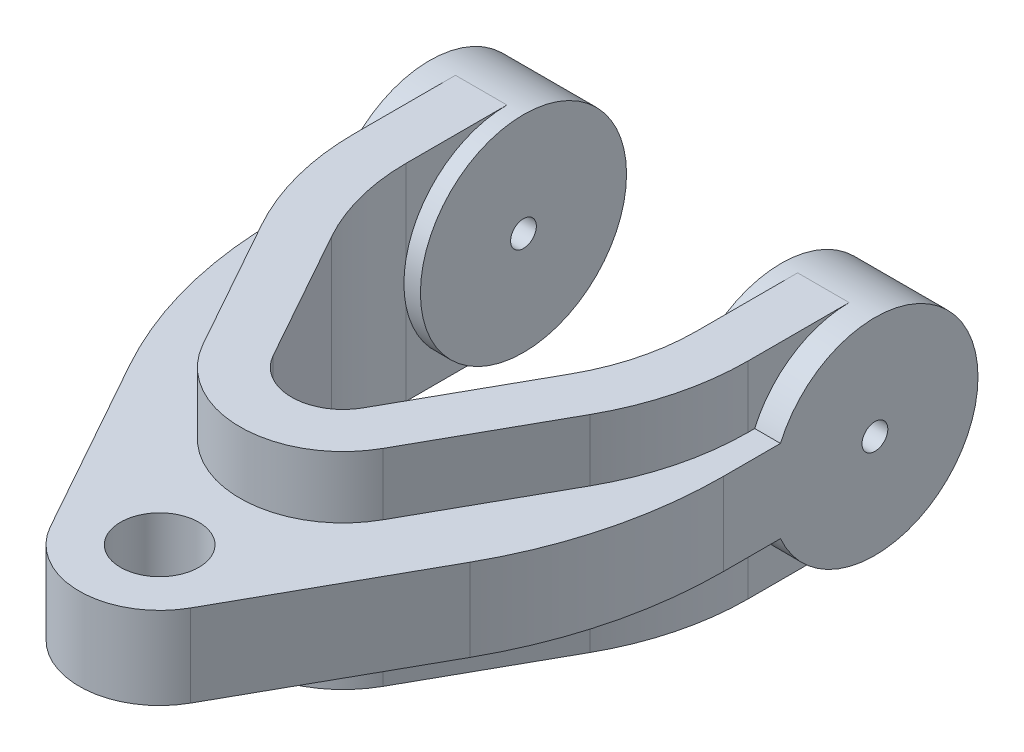
from build123d import *

# Parameters (mm, degrees)
BOSS_EXTRUDE1_DEPTH             = 2.54
BOSS_EXTRUDE1_DEPTH_BACK        = 2.54
BOSS_EXTRUDE2_REACH             = 44.034
SKETCH2_R                       = 6.35
BOSS_EXTRUDE2_DIRECTION_2_DEPTH = 1.016
BOSS_EXTRUDE3_DEPTH             = 1.016
BOSS_EXTRUDE3_DEPTH_BACK        = 4.7625
SKETCH3_R                       = 6.35
CUT_EXTRUDE1_DEPTH              = 46.159171383
CUT_EXTRUDE1_DEPTH_BACK         = 46.159171383
BOSS_EXTRUDE4_DEPTH             = 6.35
BOSS_EXTRUDE4_DEPTH_BACK        = 6.35
CUT_EXTRUDE2_DEPTH              = 46.159171383
CUT_EXTRUDE2_DEPTH_BACK         = 46.159171383
SKETCH7_R                       = 0.79375
FILLET1_R                       = 12.7
FILLET2_R                       = 15.875
FILLET3_R                       = 25.4
CUT_EXTRUDE3_DEPTH              = 39.905968649
CUT_EXTRUDE3_DEPTH_BACK         = 39.905968649
SKETCH8_R                       = 2.413


with BuildPart() as part:
    # Sketch1 → Boss-Extrude1 (new, two sides: drawn at the far end of the back side and taken through both)
    with BuildSketch(Plane(origin=(0, 0, 0), x_dir=(1, 0, 0), z_dir=(0, 1, 0)).offset(-BOSS_EXTRUDE1_DEPTH_BACK)):
        with BuildLine():
            Line((-13.716, 6.35), (-8.9535, 6.35))
            Line((-8.9535, 6.35), (-8.9535, -9.525))
            Line((-8.9535, -9.525), (-2.772279089, -20.597609011))
            ThreePointArc((-2.772279089, -20.597609011), (0, -22.225), (2.772279089, -20.597609011))
            Line((2.772279089, -20.597609011), (8.9535, -9.525))
            Line((8.9535, -9.525), (8.9535, 6.35))
            Line((8.9535, 6.35), (13.716, 6.35))
            Line((13.716, 6.35), (13.716, -15.944447946))
            Line((13.716, -15.944447946), (4.32475538, -32.767270057))
            ThreePointArc((4.32475538, -32.767270057), (0, -35.306), (-4.32475538, -32.767270057))
            Line((-4.32475538, -32.767270057), (-13.716, -15.944447946))
            Line((-13.716, -15.944447946), (-13.716, 6.35))
        make_face()
    extrude(amount=BOSS_EXTRUDE1_DEPTH + BOSS_EXTRUDE1_DEPTH_BACK)

    # Boss-Extrude2: up to this face of the body (flat: up to its plane)
    boss_extrude2_end = Plane(part.part.faces().sort_by_distance((-13.716, 0, 4.797223973))[0])
    # Sketch2 → Boss-Extrude2 (add, up to the picked face)
    with BuildSketch(Plane(origin=(-8.9535, 0, 0), x_dir=(0, 0, -1), z_dir=(1, 0, 0)), mode=Mode.PRIVATE) as boss_extrude2_sk1:
        Circle(SKETCH2_R)
    boss_extrude2_tool1 = split(extrude(boss_extrude2_sk1.sketch, amount=-BOSS_EXTRUDE2_REACH, mode=Mode.PRIVATE), bisect_by=boss_extrude2_end, keep=Keep.BOTH, mode=Mode.PRIVATE)
    add(boss_extrude2_tool1.solids().sort_by(Axis((-8.9535, 0, 0), (-1, 0, 0)))[0])

    # Sketch2 → Boss-Extrude2 direction 2 (add)
    with BuildSketch(Plane(origin=(-8.9535, 0, 0), x_dir=(0, 0, -1), z_dir=(1, 0, 0))):
        Circle(SKETCH2_R)
    extrude(amount=BOSS_EXTRUDE2_DIRECTION_2_DEPTH)

    # Sketch3 → Boss-Extrude3 (add, two sides: drawn at the far end of the back side and taken through both)
    with BuildSketch(Plane.ZY.offset(-8.9535).offset(-BOSS_EXTRUDE3_DEPTH_BACK)):
        with Locations(Location((0, 0, 0), (0, 0, 180))):
            Circle(SKETCH3_R)
    extrude(amount=BOSS_EXTRUDE3_DEPTH + BOSS_EXTRUDE3_DEPTH_BACK)

    # Sketch4 → Cut-Extrude1 (cut, two sides: drawn at the far end of the back side and taken through both)
    with BuildSketch(Plane(origin=(13.716, 0, 0), x_dir=(0, 0, -1), z_dir=(1, 0, 0)).offset(-CUT_EXTRUDE1_DEPTH_BACK)):
        with BuildLine():
            Line((3.81, 5.08), (13.97, 5.08))
            Line((13.97, 5.08), (13.97, -5.08))
            Line((13.97, -5.08), (3.81, -5.08))
            ThreePointArc((3.81, -5.08), (6.35, 0), (3.81, 5.08))
        make_face()
    extrude(amount=CUT_EXTRUDE1_DEPTH + CUT_EXTRUDE1_DEPTH_BACK, mode=Mode.SUBTRACT)

    # Sketch6 → Boss-Extrude4 (add, two sides: drawn at the far end of the back side and taken through both)
    with BuildSketch(Plane(origin=(0, 0, 0), x_dir=(1, 0, 0), z_dir=(0, 1, 0)).offset(-BOSS_EXTRUDE4_DEPTH_BACK)):
        with BuildLine():
            Line((-8.9535, -9.525), (-2.772279089, -20.597609011))
            ThreePointArc((-2.772279089, -20.597609011), (0, -22.225), (2.772279089, -20.597609011))
            Line((2.772279089, -20.597609011), (8.9535, -9.525))
            Line((8.9535, -9.525), (8.9535, 0))
            Line((8.9535, 0), (12.1285, 0))
            Line((12.1285, 0), (12.1285, -10.351202795))
            Line((12.1285, -10.351202795), (5.544558179, -22.145218022))
            ThreePointArc((5.544558179, -22.145218022), (0, -25.4), (-5.544558179, -22.145218022))
            Line((-5.544558179, -22.145218022), (-12.1285, -10.351202795))
            Line((-12.1285, -10.351202795), (-12.1285, 0))
            Line((-12.1285, 0), (-8.9535, 0))
            Line((-8.9535, 0), (-8.9535, -9.525))
        make_face()
    extrude(amount=BOSS_EXTRUDE4_DEPTH + BOSS_EXTRUDE4_DEPTH_BACK)

    # Sketch7 → Cut-Extrude2 (cut, two sides: drawn at the far end of the back side and taken through both)
    with BuildSketch(Plane(origin=(13.716, 0, 0), x_dir=(0, 0, -1), z_dir=(1, 0, 0)).offset(-CUT_EXTRUDE2_DEPTH_BACK)):
        Circle(SKETCH7_R)
    extrude(amount=CUT_EXTRUDE2_DEPTH + CUT_EXTRUDE2_DEPTH_BACK, mode=Mode.SUBTRACT)

    # Fillet1
    fillet1_edges = [part.edges().sort_by_distance(p)[0] for p in [
        (-8.9535, 0, 9.525),
        (8.9535, 0, 9.525),
    ]]
    fillet(fillet1_edges, radius=FILLET1_R)

    # Fillet2
    fillet2_edges = [part.edges().sort_by_distance(p)[0] for p in [
        (-12.1285, -4.445, 10.351202795),
        (12.1285, -4.445, 10.351202795),
        (-12.1285, 4.445, 10.351202795),
        (12.1285, 4.445, 10.351202795),
    ]]
    fillet(fillet2_edges, radius=FILLET2_R)

    # Fillet3
    fillet3_edges = [part.edges().sort_by_distance(p)[0] for p in [
        (13.716, 0, 15.944447946),
        (-13.716, 0, 15.944447946),
    ]]
    fillet(fillet3_edges, radius=FILLET3_R)

    # Sketch8 → Cut-Extrude3 (cut, two sides: drawn at the far end of the back side and taken through both)
    with BuildSketch(Plane(origin=(0, 2.54, 0), x_dir=(1, 0, 0), z_dir=(0, 1, 0)).offset(-CUT_EXTRUDE3_DEPTH_BACK)):
        with Locations(Location((0, -30.353, 0), (0, 0, 270))):
            Circle(SKETCH8_R)
    extrude(amount=CUT_EXTRUDE3_DEPTH + CUT_EXTRUDE3_DEPTH_BACK, mode=Mode.SUBTRACT)


solid = part.part
